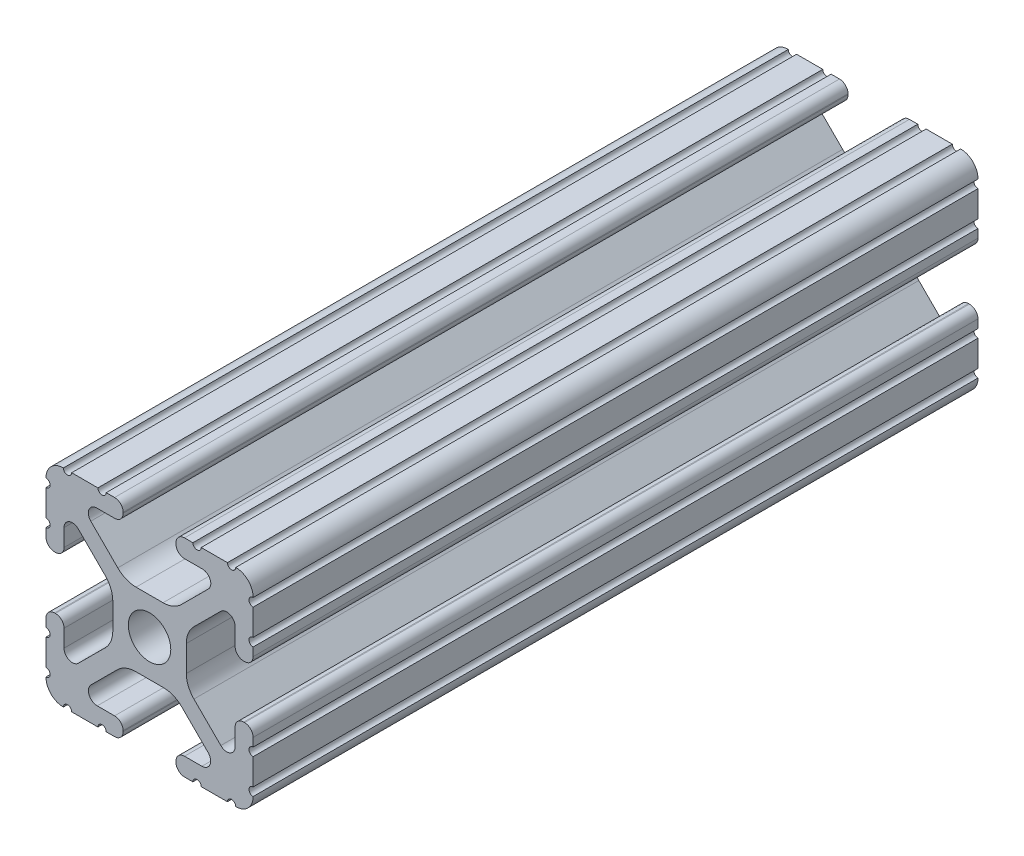
from build123d import *

# Parameters (mm, degrees)
SKETCH1_R           = 2.6035
BOSS_EXTRUDE1_DEPTH = 44.45


with BuildPart() as part:
    # Sketch1 → Boss-Extrude1 (new, symmetric)
    with BuildSketch(Plane.XY):
        with BuildLine():
            Line((-7.179650497, -8.645192506), (-3.952270251, -5.423690499))
            ThreePointArc((-3.952270251, -5.423690499), (-2.922936451, -4.736929036), (-1.709253557, -4.4958))
            Line((-1.709253557, -4.4958), (1.709253557, -4.4958))
            ThreePointArc((1.709253557, -4.4958), (2.922936451, -4.736929036), (3.952270251, -5.423690499))
            Line((3.952270251, -5.423690499), (7.179650497, -8.645192506))
            ThreePointArc((7.179650497, -8.645192506), (7.41473083, -9.822813117), (6.416408329, -10.4902))
            Line((6.416408329, -10.4902), (4.287512407, -10.4902))
            ThreePointArc((4.287512407, -10.4902), (3.54574862, -10.79744862), (3.2385, -11.539212407))
            Line((3.2385, -11.539212407), (3.2385, -11.650987593))
            ThreePointArc((3.2385, -11.650987593), (3.54574862, -12.39275138), (4.287512407, -12.7))
            Line((4.287512407, -12.7), (5.317126718, -12.7))
            ThreePointArc((5.317126718, -12.7), (5.825126718, -12.192), (6.333126718, -12.7))
            Line((6.333126718, -12.7), (9.550443118, -12.7))
            ThreePointArc((9.550443118, -12.7), (10.058366869, -12.192000006), (10.566443095, -12.699847501))
            ThreePointArc((10.566443095, -12.699847501), (12.082537762, -12.08250727), (12.699846982, -10.566399977))
            ThreePointArc((12.699846982, -10.566399977), (12.192000006, -10.058323491), (12.7, -9.5504))
            Line((12.7, -9.5504), (12.7, -6.3330836))
            ThreePointArc((12.7, -6.3330836), (12.192, -5.8250836), (12.7, -5.3170836))
            Line((12.7, -5.3170836), (12.7, -4.287469289))
            ThreePointArc((12.7, -4.287469289), (12.39275138, -3.545705502), (11.650987593, -3.238456882))
            Line((11.650987593, -3.238456882), (11.539212407, -3.238456882))
            ThreePointArc((11.539212407, -3.238456882), (10.79744862, -3.545705502), (10.4902, -4.287469289))
            Line((10.4902, -4.287469289), (10.4902, -6.402089023))
            ThreePointArc((10.4902, -6.402089023), (9.856505071, -7.351067942), (8.737131347, -7.129408934))
            Line((8.737131347, -7.129408934), (5.441005833, -3.840816462))
            ThreePointArc((5.441005833, -3.840816462), (4.750877967, -2.809883091), (4.5085, -1.593185507))
            Line((4.5085, -1.593185507), (4.5085, 1.593185507))
            ThreePointArc((4.5085, 1.593185507), (4.750877967, 2.809883091), (5.441005833, 3.840816462))
            Line((5.441005833, 3.840816462), (8.737131347, 7.129408934))
            ThreePointArc((8.737131347, 7.129408934), (9.856505071, 7.351067942), (10.4902, 6.402089023))
            Line((10.4902, 6.402089023), (10.4902, 4.287469289))
            ThreePointArc((10.4902, 4.287469289), (10.79744862, 3.545705502), (11.539212407, 3.238456882))
            Line((11.539212407, 3.238456882), (11.650987593, 3.238456882))
            ThreePointArc((11.650987593, 3.238456882), (12.39275138, 3.545705502), (12.7, 4.287469289))
            Line((12.7, 4.287469289), (12.7, 5.3170836))
            ThreePointArc((12.7, 5.3170836), (12.192, 5.8250836), (12.7, 6.3330836))
            Line((12.7, 6.3330836), (12.7, 9.5504))
            ThreePointArc((12.7, 9.5504), (12.192000006, 10.058323491), (12.699846982, 10.566399977))
            ThreePointArc((12.699846982, 10.566399977), (12.082537762, 12.08250727), (10.566443095, 12.699847501))
            ThreePointArc((10.566443095, 12.699847501), (10.058366869, 12.192000006), (9.550443118, 12.7))
            Line((9.550443118, 12.7), (6.333126718, 12.7))
            ThreePointArc((6.333126718, 12.7), (5.825126718, 12.192), (5.317126718, 12.7))
            Line((5.317126718, 12.7), (4.287512407, 12.7))
            ThreePointArc((4.287512407, 12.7), (3.54574862, 12.39275138), (3.2385, 11.650987593))
            Line((3.2385, 11.650987593), (3.2385, 11.539212407))
            ThreePointArc((3.2385, 11.539212407), (3.54574862, 10.79744862), (4.287512407, 10.4902))
            Line((4.287512407, 10.4902), (6.476788598, 10.4902))
            ThreePointArc((6.476788598, 10.4902), (7.432222385, 9.85140422), (7.207036008, 8.724370562))
            Line((7.207036008, 8.724370562), (3.898272566, 5.423169045))
            ThreePointArc((3.898272566, 5.423169045), (2.869120213, 4.736787962), (1.655778399, 4.4958))
            Line((1.655778399, 4.4958), (-1.655778399, 4.4958))
            ThreePointArc((-1.655778399, 4.4958), (-2.869120213, 4.736787962), (-3.898272566, 5.423169045))
            Line((-3.898272566, 5.423169045), (-7.207036008, 8.724370562))
            ThreePointArc((-7.207036008, 8.724370562), (-7.432222385, 9.85140422), (-6.476788598, 10.4902))
            Line((-6.476788598, 10.4902), (-4.287512407, 10.4902))
            ThreePointArc((-4.287512407, 10.4902), (-3.54574862, 10.79744862), (-3.2385, 11.539212407))
            Line((-3.2385, 11.539212407), (-3.2385, 11.650987593))
            ThreePointArc((-3.2385, 11.650987593), (-3.54574862, 12.39275138), (-4.287512407, 12.7))
            Line((-4.287512407, 12.7), (-5.317126718, 12.7))
            ThreePointArc((-5.317126718, 12.7), (-5.825126718, 12.192), (-6.333126718, 12.7))
            Line((-6.333126718, 12.7), (-9.550443118, 12.7))
            ThreePointArc((-9.550443118, 12.7), (-10.058366869, 12.192000006), (-10.566443095, 12.699847501))
            ThreePointArc((-10.566443095, 12.699847501), (-12.082537762, 12.08250727), (-12.699846982, 10.566399977))
            ThreePointArc((-12.699846982, 10.566399977), (-12.192000006, 10.058323491), (-12.7, 9.5504))
            Line((-12.7, 9.5504), (-12.7, 6.3330836))
            ThreePointArc((-12.7, 6.3330836), (-12.192, 5.8250836), (-12.7, 5.3170836))
            Line((-12.7, 5.3170836), (-12.7, 4.287469289))
            ThreePointArc((-12.7, 4.287469289), (-12.39275138, 3.545705502), (-11.650987593, 3.238456882))
            Line((-11.650987593, 3.238456882), (-11.539212407, 3.238456882))
            ThreePointArc((-11.539212407, 3.238456882), (-10.79744862, 3.545705502), (-10.4902, 4.287469289))
            Line((-10.4902, 4.287469289), (-10.4902, 6.402089023))
            ThreePointArc((-10.4902, 6.402089023), (-9.856505071, 7.351067942), (-8.737131347, 7.129408934))
            Line((-8.737131347, 7.129408934), (-5.441005833, 3.840816462))
            ThreePointArc((-5.441005833, 3.840816462), (-4.750877967, 2.809883091), (-4.5085, 1.593185507))
            Line((-4.5085, 1.593185507), (-4.5085, -1.593185507))
            ThreePointArc((-4.5085, -1.593185507), (-4.750877967, -2.809883091), (-5.441005833, -3.840816462))
            Line((-5.441005833, -3.840816462), (-8.737131347, -7.129408934))
            ThreePointArc((-8.737131347, -7.129408934), (-9.856505071, -7.351067942), (-10.4902, -6.402089023))
            Line((-10.4902, -6.402089023), (-10.4902, -4.287469289))
            ThreePointArc((-10.4902, -4.287469289), (-10.79744862, -3.545705502), (-11.539212407, -3.238456882))
            Line((-11.539212407, -3.238456882), (-11.650987593, -3.238456882))
            ThreePointArc((-11.650987593, -3.238456882), (-12.39275138, -3.545705502), (-12.7, -4.287469289))
            Line((-12.7, -4.287469289), (-12.7, -5.3170836))
            ThreePointArc((-12.7, -5.3170836), (-12.192, -5.8250836), (-12.7, -6.3330836))
            Line((-12.7, -6.3330836), (-12.7, -9.5504))
            ThreePointArc((-12.7, -9.5504), (-12.192000006, -10.058323491), (-12.699846982, -10.566399977))
            ThreePointArc((-12.699846982, -10.566399977), (-12.082537762, -12.08250727), (-10.566443095, -12.699847501))
            ThreePointArc((-10.566443095, -12.699847501), (-10.058366869, -12.192000006), (-9.550443118, -12.7))
            Line((-9.550443118, -12.7), (-6.333126718, -12.7))
            ThreePointArc((-6.333126718, -12.7), (-5.825126718, -12.192), (-5.317126718, -12.7))
            Line((-5.317126718, -12.7), (-4.287512407, -12.7))
            ThreePointArc((-4.287512407, -12.7), (-3.54574862, -12.39275138), (-3.2385, -11.650987593))
            Line((-3.2385, -11.650987593), (-3.2385, -11.539212407))
            ThreePointArc((-3.2385, -11.539212407), (-3.54574862, -10.79744862), (-4.287512407, -10.4902))
            Line((-4.287512407, -10.4902), (-6.416408329, -10.4902))
            ThreePointArc((-6.416408329, -10.4902), (-7.41473083, -9.822813117), (-7.179650497, -8.645192506))
        make_face()
        Circle(SKETCH1_R, mode=Mode.SUBTRACT)
    extrude(amount=BOSS_EXTRUDE1_DEPTH, both=True)


solid = part.part
